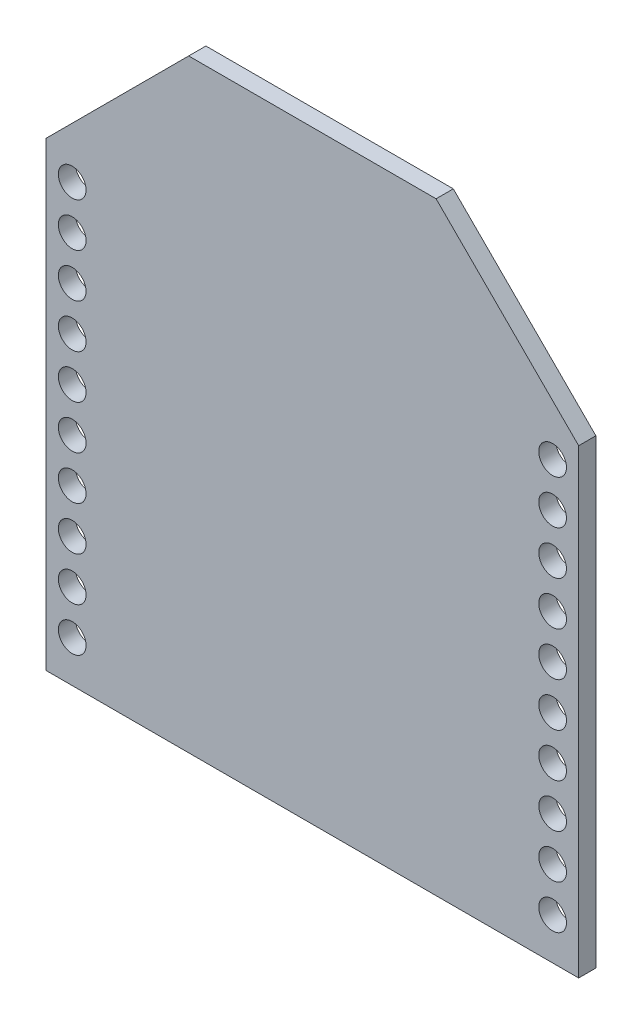
from build123d import *

# Parameters (mm, degrees)
CROQUIS1_R              = 0.635
SALIENTE_EXTRUIR1_DEPTH = 0.7874


with BuildPart() as part:
    # Croquis1 → Saliente-Extruir1 (new body)
    with BuildSketch(Plane.XY):
        Polygon((-5.6642, 13.8176), (-12.192, 7.2898), (-12.192, -13.8176), (12.192, -13.8176), (12.192, 7.2898), (5.6642, 13.8176), align=None)
        with Locations((-10.9982, -11.9126)):
            Circle(CROQUIS1_R, mode=Mode.SUBTRACT)
        with Locations((10.9982, -11.9126)):
            Circle(CROQUIS1_R, mode=Mode.SUBTRACT)
        with Locations((10.9982, -9.906)):
            Circle(CROQUIS1_R, mode=Mode.SUBTRACT)
        with Locations((10.9982, -7.8994)):
            Circle(CROQUIS1_R, mode=Mode.SUBTRACT)
        with Locations((10.9982, -5.8928)):
            Circle(CROQUIS1_R, mode=Mode.SUBTRACT)
        with Locations((10.9982, -3.8862)):
            Circle(CROQUIS1_R, mode=Mode.SUBTRACT)
        with Locations((10.9982, -1.8796)):
            Circle(CROQUIS1_R, mode=Mode.SUBTRACT)
        with Locations((10.9982, 0.127)):
            Circle(CROQUIS1_R, mode=Mode.SUBTRACT)
        with Locations((10.9982, 2.1336)):
            Circle(CROQUIS1_R, mode=Mode.SUBTRACT)
        with Locations((10.9982, 4.1402)):
            Circle(CROQUIS1_R, mode=Mode.SUBTRACT)
        with Locations((10.9982, 6.1468)):
            Circle(CROQUIS1_R, mode=Mode.SUBTRACT)
        with Locations((-10.9982, -9.906)):
            Circle(CROQUIS1_R, mode=Mode.SUBTRACT)
        with Locations((-10.9982, -7.8994)):
            Circle(CROQUIS1_R, mode=Mode.SUBTRACT)
        with Locations((-10.9982, -5.8928)):
            Circle(CROQUIS1_R, mode=Mode.SUBTRACT)
        with Locations((-10.9982, -3.8862)):
            Circle(CROQUIS1_R, mode=Mode.SUBTRACT)
        with Locations((-10.9982, -1.8796)):
            Circle(CROQUIS1_R, mode=Mode.SUBTRACT)
        with Locations((-10.9982, 0.127)):
            Circle(CROQUIS1_R, mode=Mode.SUBTRACT)
        with Locations((-10.9982, 2.1336)):
            Circle(CROQUIS1_R, mode=Mode.SUBTRACT)
        with Locations((-10.9982, 4.1402)):
            Circle(CROQUIS1_R, mode=Mode.SUBTRACT)
        with Locations((-10.9982, 6.1468)):
            Circle(CROQUIS1_R, mode=Mode.SUBTRACT)
    extrude(amount=SALIENTE_EXTRUIR1_DEPTH)


solid = part.part
